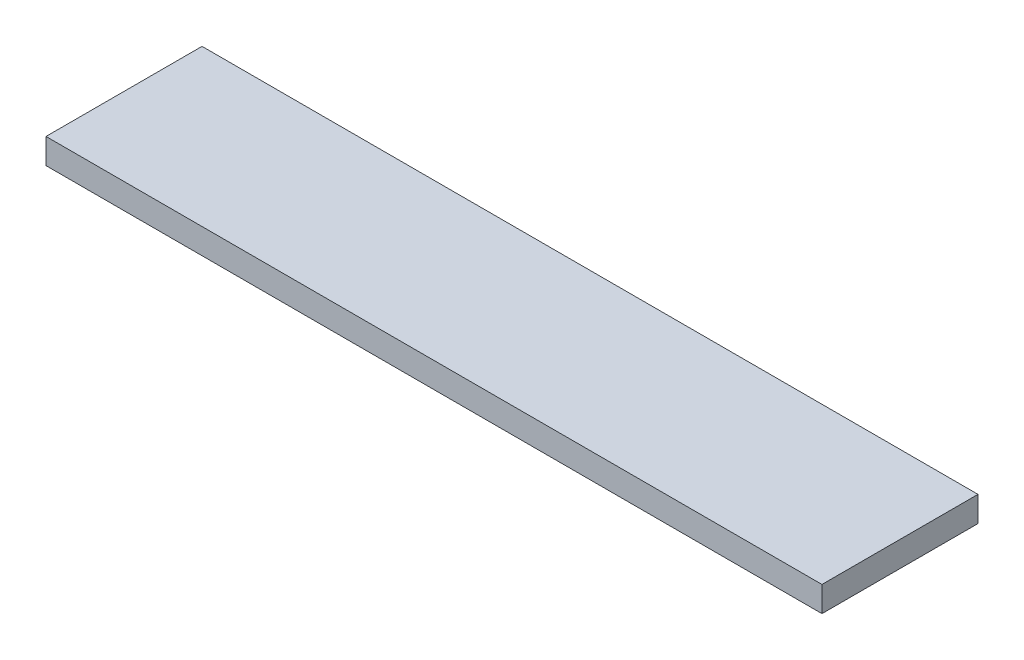
from build123d import *

# Parameters (mm, degrees)
SKETCH1_W           = 1168.4
SKETCH1_H           = 234.95
BOSS_EXTRUDE1_DEPTH = 38.1


with BuildPart() as part:
    # Sketch1 → Boss-Extrude1 (new body)
    with BuildSketch(Plane(origin=(0, 0, 0), x_dir=(1, 0, 0), z_dir=(0, 1, 0))):
        with Locations((160.509379861, 286.740053763)):
            Rectangle(SKETCH1_W, SKETCH1_H)
    extrude(amount=BOSS_EXTRUDE1_DEPTH)


solid = part.part
